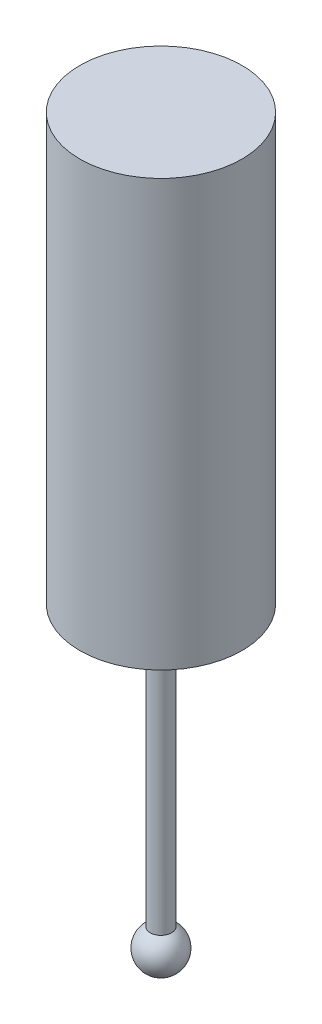
from build123d import *

# Parameters (mm, degrees)
SKETCH1_R                = 19.05
BOSS_EXTRUDE1_DEPTH      = 100
BOSS_EXTRUDE2_REACH      = 105.565
BOSS_EXTRUDE2_END_RADIUS = 5
SKETCH3_R                = 2.5


with BuildPart() as part:
    # Sketch1 → Boss-Extrude1 (new body)
    with BuildSketch(Plane(origin=(0, 70, 0), x_dir=(-1, 0, 0), z_dir=(0, 1, 0))):
        with Locations(Location((0, 0, 0), (0, 0, 90))):
            Circle(SKETCH1_R)
    extrude(amount=BOSS_EXTRUDE1_DEPTH)



with BuildPart() as body_2:
    # Sketch2 → Revolve1 (revolve)
    with BuildSketch(Plane(origin=(0, 0, 0), x_dir=(1, 0, 0), z_dir=(0, 1, 0))):
        with BuildLine():
            Line((-5, 0), (5, 0))
            ThreePointArc((5, 0), (0, -5), (-5, 0))
        make_face()
    revolve(axis=Axis((-5, 0, 0), (1, 0, 0)))


with BuildPart() as part_1:
    add(part.part)

    add(body_2.part)  # Boss-Extrude2 merges body 2
    # Boss-Extrude2: up to this sphere (the profile starts outside it)
    boss_extrude2_end = Location((0, 0, 0)) * Sphere(BOSS_EXTRUDE2_END_RADIUS, mode=Mode.PRIVATE)
    # Sketch3 → Boss-Extrude2 (add, up to the surface)
    with BuildSketch(Plane.XZ.offset(-70), mode=Mode.PRIVATE) as boss_extrude2_sk1:
        with Locations(Location((0, 0, 0), (0, 0, 90))):
            Circle(SKETCH3_R)
    boss_extrude2_tool1 = extrude(boss_extrude2_sk1.sketch, amount=BOSS_EXTRUDE2_REACH, mode=Mode.PRIVATE) - boss_extrude2_end
    add(boss_extrude2_tool1.solids().sort_by_distance((0, 70, 0))[0])


solid = part_1.part
